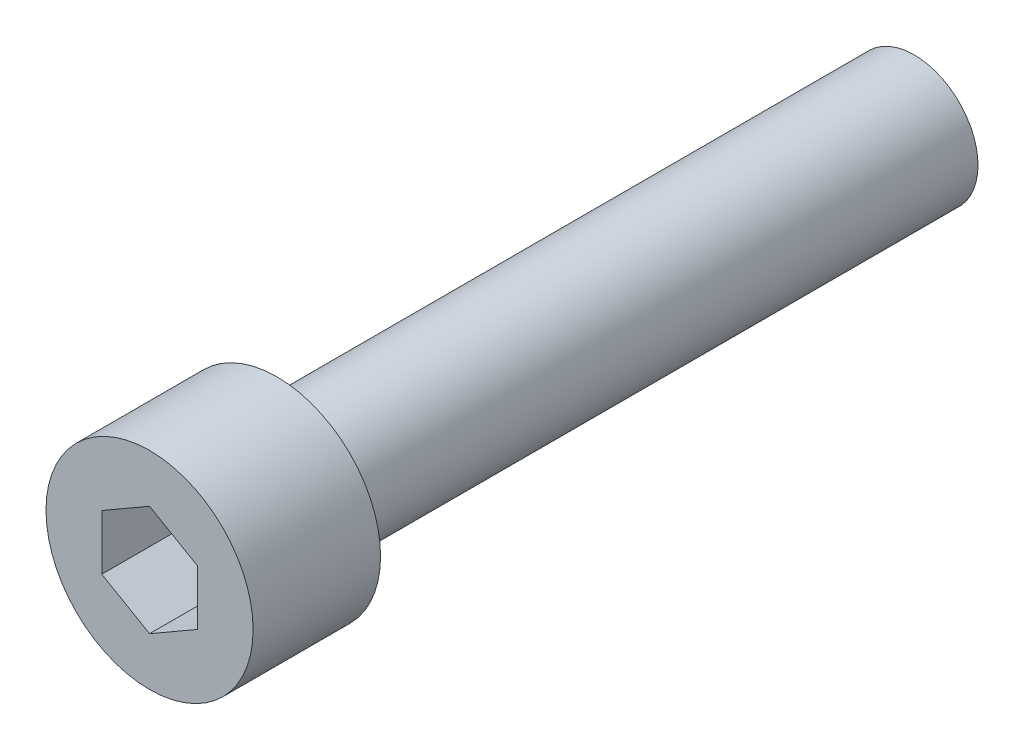
from build123d import *

# Parameters (mm, degrees)
WYTNIJ_WYCI_GNI_CIE1_DEPTH = 6


with BuildPart() as part:
    # Szkic1 → Obrót1 (revolve)
    with BuildSketch(Plane(origin=(0, 0, 0), x_dir=(0, 0, -1), z_dir=(1, 0, 0)), mode=Mode.PRIVATE) as obr_t1_sk:
        Polygon((0, 0), (0, 6.5), (8, 6.5), (8, 4), (48, 4), (48, 0), align=None)
    revolve(obr_t1_sk.sketch.rotate(Axis((0, 0, 0), (0, 0, -1)), 90), axis=Axis((0, 0, 0), (0, 0, -1)))

    # Szkic2 → Wytnij-wyciągnięcie1 (cut)
    with BuildSketch(Plane.XY):
        Polygon((-3, -1.732050808), (0, -3.464101615), (3, -1.732050808), (3, 1.732050808), (0, 3.464101615), (-3, 1.732050808), align=None)
    extrude(amount=-WYTNIJ_WYCI_GNI_CIE1_DEPTH, mode=Mode.SUBTRACT)


solid = part.part
